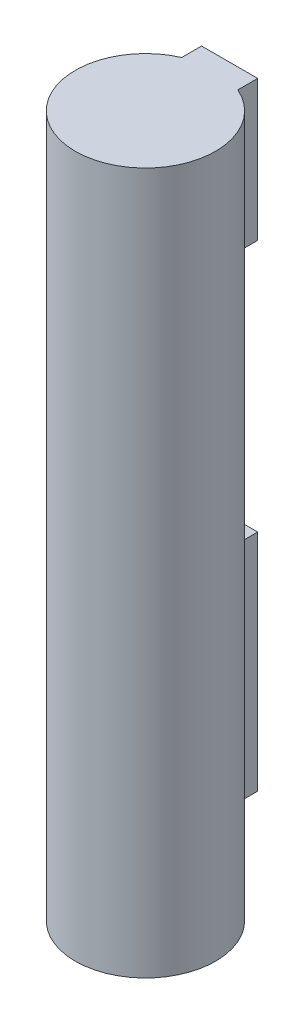
from build123d import *

# Parameters (mm, degrees)
SKETCH_1_R      = 2.5
EXTRUDE_1_DEPTH = 25
SKETCH_2_W      = 2
SKETCH_2_H      = 1
EXTRUDE_2_DEPTH = 8
EXTRUDE_START   = -5
EXTRUDE_3_DEPTH = 5


with BuildPart() as part:
    # 草图1 → 凸台-拉伸1 (new body)
    with BuildSketch(Plane(origin=(0, 0, 0), x_dir=(1, 0, 0), z_dir=(0, 1, 0))):
        with Locations(Location((0, 0, 0), (0, 0, 270))):
            Circle(SKETCH_1_R)
    extrude(amount=EXTRUDE_1_DEPTH)

    # 草图2 → 凸台-拉伸2 (add)
    with BuildSketch(Plane(origin=(0, 3, 0), x_dir=(-1, 0, 0), z_dir=(0, -1, 0))):
        with Locations((0, 2.5)):
            Rectangle(SKETCH_2_W, SKETCH_2_H)
    extrude(amount=-EXTRUDE_2_DEPTH)

    # 草图3 → 凸台-拉伸3 (add)
    with BuildSketch(Plane(origin=(0, 25, 0), x_dir=(1, 0, 0), z_dir=(0, 1, 0)).offset(EXTRUDE_START)):
        with BuildLine():
            Line((-1, 3), (-1, 2.291287847))
            ThreePointArc((-1, 2.291287847), (0, 2.5), (1, 2.291287847))
            Line((1, 2.291287847), (1, 3))
            Line((1, 3), (-1, 3))
        make_face()
    extrude(amount=EXTRUDE_3_DEPTH)


solid = part.part
